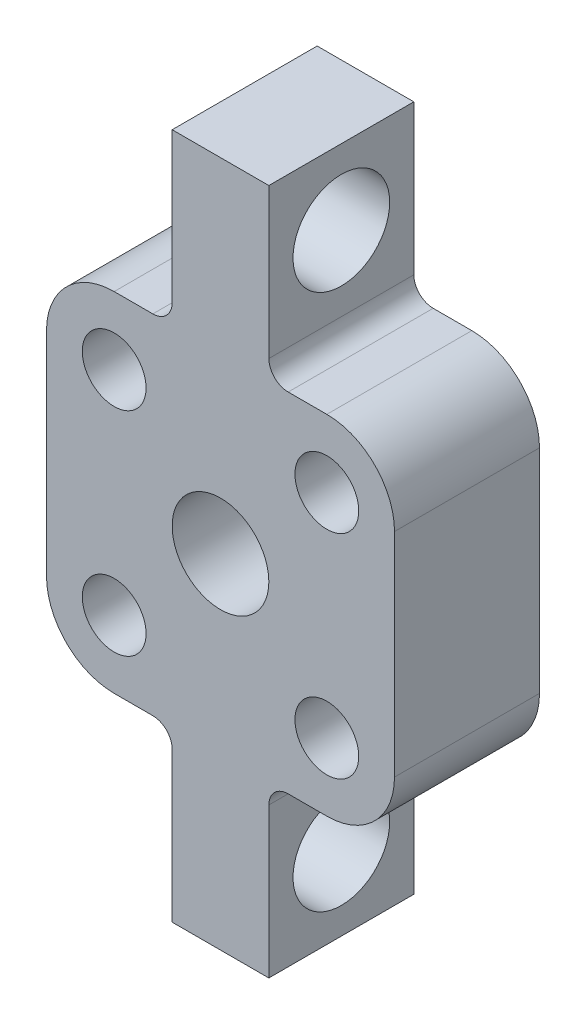
from build123d import *

# Parameters (mm, degrees)
ESBO_O1_R                  = 5
RESSALTO_EXTRUS_O1_DEPTH   = 15
FURO_COM_FOLGA_DE_M61_D    = 6.6
CORTE_EXTRUS_O1_DEPTH      = 43.535279475
CORTE_EXTRUS_O1_DEPTH_BACK = 43.535279475
ESBO_O4_R                  = 5


with BuildPart() as part:
    # Esboço1 → Ressalto-extrusão1 (new body)
    with BuildSketch(Plane.XY):
        with BuildLine():
            Line((-5, -20), (-5, -35.5))
            Line((-5, -35.5), (5, -35.5))
            Line((5, -35.5), (5, -20))
            ThreePointArc((5, -20), (5.585786438, -18.585786438), (7, -18))
            Line((7, -18), (11, -18))
            ThreePointArc((11, -18), (15.949747468, -15.949747468), (18, -11))
            Line((18, -11), (18, 11))
            ThreePointArc((18, 11), (15.949747468, 15.949747468), (11, 18))
            Line((11, 18), (7, 18))
            ThreePointArc((7, 18), (5.585786438, 18.585786438), (5, 20))
            Line((5, 20), (5, 35.5))
            Line((5, 35.5), (-5, 35.5))
            Line((-5, 35.5), (-5, 20))
            ThreePointArc((-5, 20), (-5.585786438, 18.585786438), (-7, 18))
            Line((-7, 18), (-11, 18))
            ThreePointArc((-11, 18), (-15.949747468, 15.949747468), (-18, 11))
            Line((-18, 11), (-18, -11))
            ThreePointArc((-18, -11), (-15.949747468, -15.949747468), (-11, -18))
            Line((-11, -18), (-7, -18))
            ThreePointArc((-7, -18), (-5.585786438, -18.585786438), (-5, -20))
        make_face()
        Circle(ESBO_O1_R, mode=Mode.SUBTRACT)
    extrude(amount=RESSALTO_EXTRUS_O1_DEPTH)

    # Furo com folga de M61 (through all)
    with Locations(Plane.XY.offset(15)):
        with Locations((11, 11), (-11, 11), (-11, -11), (11, -11)):
            Hole(FURO_COM_FOLGA_DE_M61_D / 2)

    # Esboço4 → Corte-extrusão1 (cut, two sides: drawn at the far end of the back side and taken through both)
    with BuildSketch(Plane(origin=(0, 0, 0), x_dir=(0, 0, -1), z_dir=(1, 0, 0)).offset(-CORTE_EXTRUS_O1_DEPTH_BACK)):
        with Locations(Location((-7.5, 27.75, 0), (0, 0, 90))):
            Circle(ESBO_O4_R)
        with Locations(Location((-7.5, -27.75, 0), (0, 0, 90))):
            Circle(ESBO_O4_R)
    extrude(amount=CORTE_EXTRUS_O1_DEPTH + CORTE_EXTRUS_O1_DEPTH_BACK, mode=Mode.SUBTRACT)


solid = part.part
